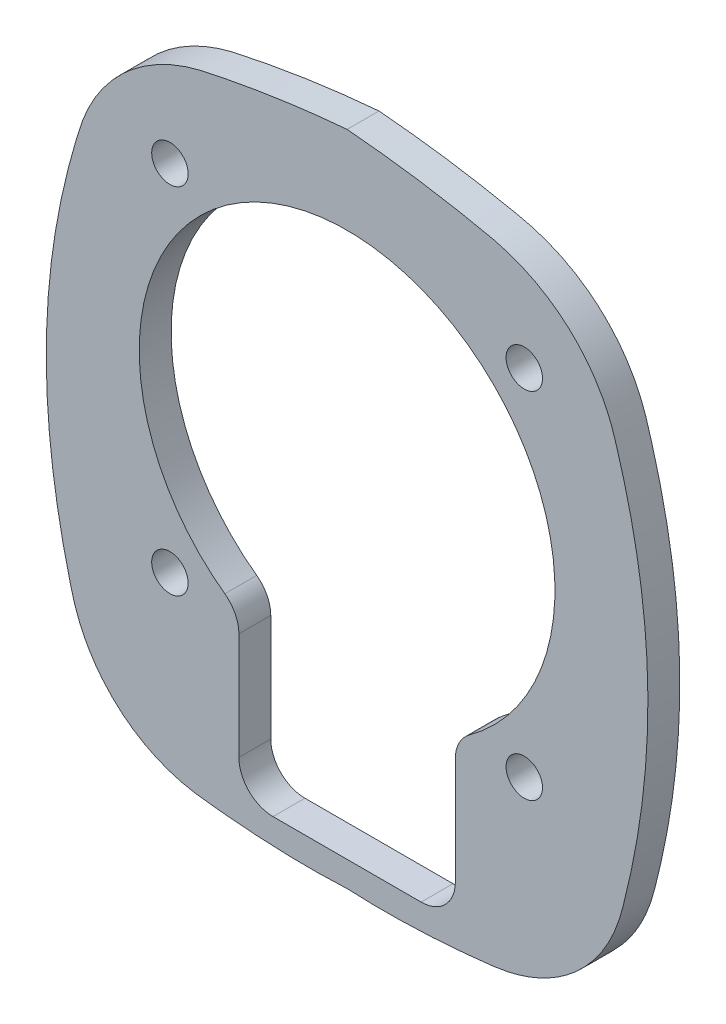
from build123d import *

# Parameters (mm, degrees)
SKETCH_1_R      = 1.6
EXTRUDE_1_DEPTH = 1.4


with BuildPart() as part:
    # Эскиз1 → Бобышка-Вытянуть1 (new, symmetric)
    with BuildSketch(Plane.XY):
        with BuildLine():
            add(Edge.make_bspline(
                [(0, 71.831470018), (0.224416179, 71.820521503), (0.684147103, 71.798092768), (1.390553246, 71.77394313), (2.129936147, 71.756509949), (3.120275382, 71.74483738), (4.340849325, 71.750217073), (6.266834443, 71.797645626), (8.216765497, 71.904490636), (10.138363938, 72.060642203), (11.317506615, 72.175559831), (12.190762764, 72.272185641), (12.805513935, 72.34273449), (13.37772465, 72.421015924), (13.905793885, 72.51624936), (14.710527508, 72.690687443), (15.800793475, 73.010372547), (17.141904851, 73.568840352), (18.417290334, 74.275623423), (19.992263936, 75.396111642), (21.361320354, 76.772642414), (22.481227657, 78.351307534), (23.068879442, 79.405660146), (23.47491154, 80.294917035), (23.729868011, 80.941501678), (23.965799926, 81.633834828), (24.153338764, 82.306879474), (24.330358453, 83.00364592), (24.498623524, 83.682852837), (24.672935215, 84.420326333), (24.894452544, 85.403785706), (25.147911089, 86.617394475), (25.514893824, 88.575319472), (25.882308723, 90.962184892), (26.300820369, 94.804193168), (26.463913272, 98.662356192), (26.342005837, 102.541634909), (26.106073622, 105.475217496), (25.739905361, 108.321403549), (25.227143621, 111.202492324), (24.589229676, 114.018264761), (24.012742476, 116.128067688), (23.594450813, 117.509879625), (23.392959669, 118.162199377), (23.144559301, 118.849290868), (22.578937407, 120.197043553), (21.395813943, 122.20366756), (19.396198372, 124.35989197), (17.580783875, 125.655403223), (16.320150391, 126.345818353), (15.599775822, 126.690785698), (14.886977613, 126.987530367), (14.185674872, 127.239235753), (13.4992906, 127.449114007), (12.830466587, 127.621163827), (12.180109738, 127.758284309), (11.275940312, 127.947686764), (10.10864648, 128.178443045), (8.671063895, 128.441470677), (7.23596598, 128.681619076), (5.794651251, 128.900345473), (4.352526893, 129.096713978), (2.909802689, 129.270791509), (1.461468081, 129.42574856), (0.491356771, 129.511830561), (0, 129.555430685)],
                knots=[0, 0, 0, 0, 0.007244605, 0.014841038, 0.022789911, 0.031091474, 0.046775107, 0.062143324, 0.093208403, 0.109725275, 0.12430576, 0.131406773, 0.138054233, 0.144257857, 0.150025241, 0.155350814, 0.170805279, 0.186580817, 0.202100267, 0.21771775, 0.248802801, 0.264074926, 0.280043131, 0.287631711, 0.295585242, 0.302443172, 0.311206798, 0.318104118, 0.32562435, 0.333768658, 0.342537986, 0.358128954, 0.37374132, 0.406765732, 0.435964931, 0.498333073, 0.531061733, 0.561065485, 0.593194037, 0.623552495, 0.655389193, 0.686254889, 0.69404876, 0.701942711, 0.708264803, 0.717598153, 0.749054081, 0.782774243, 0.811661581, 0.820522691, 0.829104834, 0.837401662, 0.84540792, 0.853120197, 0.860537068, 0.867667093, 0.874548901, 0.890324616, 0.906031654, 0.921670378, 0.937239422, 0.953035768, 0.968597359, 0.984094711, 1, 1, 1, 1], degree=3))
            add(Edge.make_bspline(
                [(0, 129.555430685), (-0.3274469, 129.526821193), (-0.97676619, 129.47008926), (-1.94136409, 129.37413494), (-3.056324136, 129.253266033), (-4.33348257, 129.099051372), (-5.930351425, 128.882090385), (-7.686739234, 128.611471892), (-9.596818382, 128.277448203), (-11.106542408, 127.982961479), (-12.225682791, 127.749046891), (-12.965665391, 127.590900371), (-13.728257741, 127.38440617), (-14.512340962, 127.12867723), (-15.313338162, 126.817150771), (-16.126082065, 126.445703171), (-17.444098211, 125.743263421), (-19.280339416, 124.458335973), (-20.897470488, 122.754065632), (-22.034433682, 121.114113169), (-22.647536356, 120.002685322), (-23.061262162, 119.056911748), (-23.290611707, 118.451294304), (-23.451372125, 117.974169765), (-23.593602687, 117.510925094), (-23.962747453, 116.29902851), (-24.520446784, 114.289265865), (-25.166074376, 111.498333257), (-25.689092368, 108.644834899), (-26.201960729, 104.828502487), (-26.499515195, 99.98054875), (-26.329237181, 95.232849809), (-25.93805017, 91.394955647), (-25.588168293, 89.015952156), (-25.230921433, 87.044071951), (-24.944100715, 85.627054403), (-24.629786889, 84.217645213), (-24.354324302, 83.095975922), (-24.148229918, 82.290039423), (-24.018866814, 81.82364516), (-23.854058531, 81.298190812), (-23.644300292, 80.71174475), (-23.261971585, 79.798161959), (-22.705487298, 78.719420483), (-21.622673835, 77.084782927), (-20.275439366, 75.645040405), (-18.70790573, 74.463273721), (-17.43352671, 73.713373036), (-16.091213811, 73.116181806), (-14.729830923, 72.683377588), (-13.290023133, 72.386934206), (-12.0157978, 72.251669974), (-10.861011854, 72.129946685), (-9.882225452, 72.040200908), (-8.690178345, 71.944054587), (-7.351893097, 71.856869551), (-5.885866144, 71.789392779), (-4.431210112, 71.751283956), (-2.93368772, 71.743598504), (-1.452459975, 71.765989714), (-0.468886907, 71.810331496), (0, 71.831470018)],
                knots=[0, 0, 0, 0, 0.010598151, 0.021015878, 0.03125472, 0.046758535, 0.062493293, 0.08321448, 0.104054482, 0.125011796, 0.132806062, 0.140920641, 0.149405541, 0.158266648, 0.167501077, 0.17710211, 0.187061294, 0.215634744, 0.248952004, 0.262142742, 0.279924845, 0.289768054, 0.295408131, 0.300800495, 0.305998819, 0.311032375, 0.341649106, 0.373225657, 0.403367609, 0.435153797, 0.497342248, 0.559715014, 0.588091433, 0.621706133, 0.63721354, 0.652703471, 0.668318924, 0.68377061, 0.689942401, 0.695141175, 0.699373983, 0.707696653, 0.715212041, 0.731297012, 0.746741468, 0.778347613, 0.79422157, 0.809930343, 0.825916928, 0.84149251, 0.855899247, 0.873234756, 0.882779729, 0.89334397, 0.904924482, 0.921339891, 0.936583372, 0.952241615, 0.96825542, 0.98486679, 1, 1, 1, 1], degree=3))
        make_face()
        with Locations((15.556349186, 119.193294207)):
            Circle(SKETCH_1_R, mode=Mode.SUBTRACT)
        with Locations(Location((15.556349186, 88.080595835, 0), (0, 0, 180))):
            Circle(SKETCH_1_R, mode=Mode.SUBTRACT)
        with Locations((-15.556349186, 88.080595835)):
            Circle(SKETCH_1_R, mode=Mode.SUBTRACT)
        with Locations(Location((-15.556349186, 119.193294207, 0), (0, 0, 180))):
            Circle(SKETCH_1_R, mode=Mode.SUBTRACT)
        with BuildLine():
            Line((-6.5, 74.054502978), (6.5, 74.054502978))
            ThreePointArc((6.5, 74.054502978), (8.621320344, 74.933182635), (9.5, 77.054502978))
            Line((9.5, 77.054502978), (9.5, 86.452286165))
            ThreePointArc((9.5, 86.452286165), (9.826601634, 87.813513984), (10.735294118, 88.87835565))
            ThreePointArc((10.735294118, 88.87835565), (0, 121.886945021), (-10.735294118, 88.87835565))
            ThreePointArc((-10.735294118, 88.87835565), (-9.826601634, 87.813513984), (-9.5, 86.452286165))
            Line((-9.5, 86.452286165), (-9.5, 77.054502978))
            ThreePointArc((-9.5, 77.054502978), (-8.621320344, 74.933182635), (-6.5, 74.054502978))
        make_face(mode=Mode.SUBTRACT)
    extrude(amount=EXTRUDE_1_DEPTH, both=True)


solid = part.part
